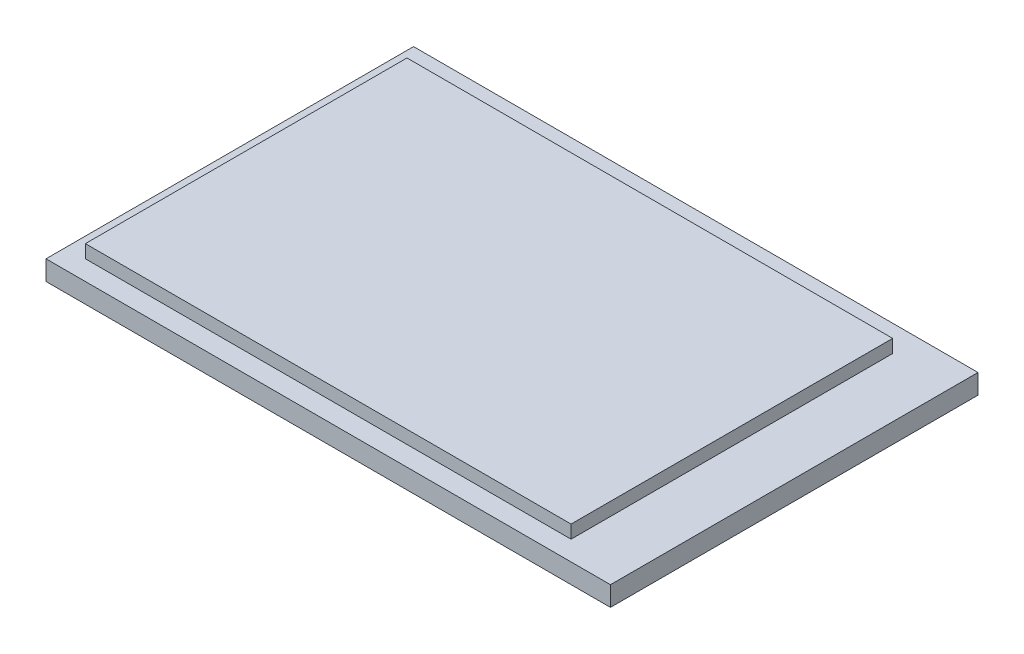
from build123d import *

# Parameters (mm, degrees)
SKETCH1_W           = 74
SKETCH1_H           = 49
BOSS_EXTRUDE1_DEPTH = 2
SKETCH2_W           = 86
SKETCH2_H           = 56
BOSS_EXTRUDE2_DEPTH = 3


with BuildPart() as part:
    # Sketch1 → Boss-Extrude1 (new body)
    with BuildSketch(Plane(origin=(0, 0, 0), x_dir=(1, 0, 0), z_dir=(0, 1, 0))):
        Rectangle(SKETCH1_W, SKETCH1_H)
    extrude(amount=BOSS_EXTRUDE1_DEPTH)


with BuildPart() as body_2:
    # Sketch2 → Boss-Extrude2 (new body)
    with BuildSketch(Plane.XZ):
        with Locations((3, -0.5)):
            Rectangle(SKETCH2_W, SKETCH2_H)
    extrude(amount=BOSS_EXTRUDE2_DEPTH)


solid = Compound([part.part, body_2.part])
